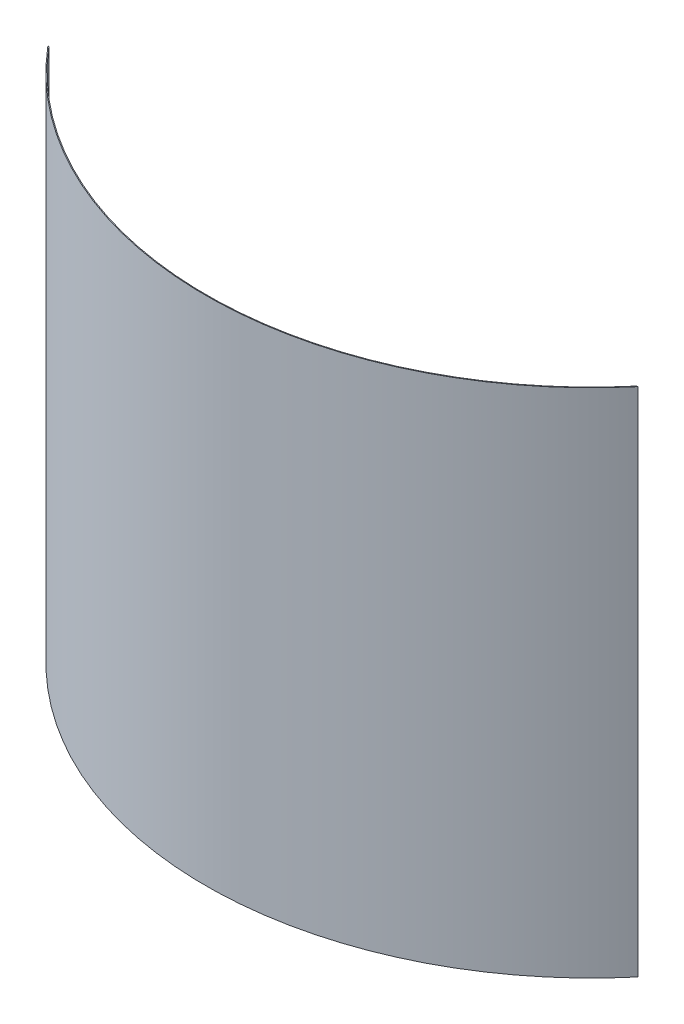
from build123d import *

# Parameters (mm, degrees)
BOSS_EXTRUDE2_DEPTH = 508


with BuildPart() as part:
    # Sketch1 → Boss-Extrude2 (new body)
    with BuildSketch(Plane(origin=(0, 0, 0), x_dir=(1, 0, 0), z_dir=(0, 1, 0))):
        with BuildLine():
            Line((292.1, -247.379439897), (293.139386835, -247.379439897))
            ThreePointArc((293.139386835, -247.379439897), (0, -383.57175), (-293.139386835, -247.379439897))
            Line((-293.139386835, -247.379439897), (-292.1, -247.379439897))
            ThreePointArc((-292.1, -247.379439897), (0, -382.778), (292.1, -247.379439897))
        make_face()
    extrude(amount=BOSS_EXTRUDE2_DEPTH)


solid = part.part
